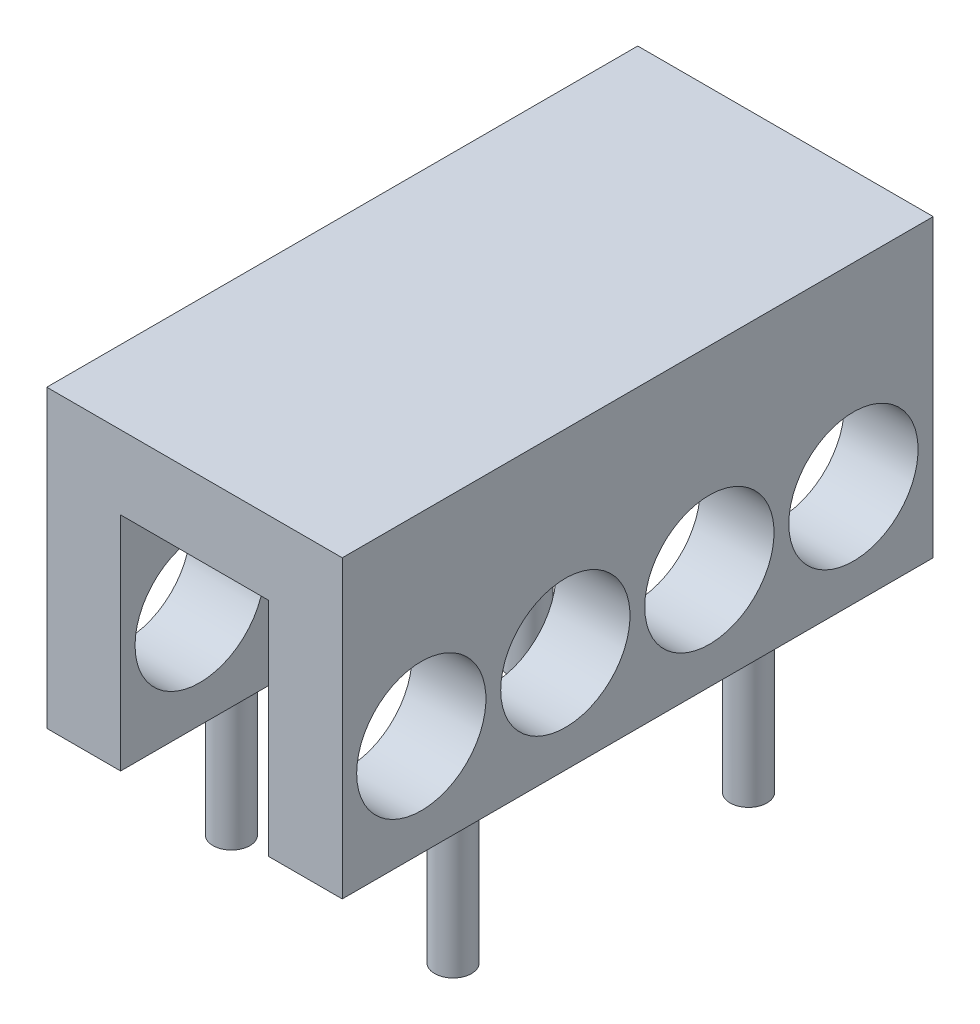
from build123d import *

# Parameters (mm, degrees)
BOSS_EXTRUDE1_DEPTH = 101.6
SKETCH5_R           = 11.1125
CUT_EXTRUDE1_DEPTH  = 125.434078933
SKETCH6_R           = 3.175
BOSS_EXTRUDE3_DEPTH = 25.4


with BuildPart() as part:
    # Sketch4 → Boss-Extrude1 (new body)
    with BuildSketch(Plane.XY):
        Polygon((0, 0), (0, 50.8), (50.8, 50.8), (50.8, 0), (38.1, 0), (38.1, 38.135977337), (12.7, 38.135977337), (12.7, 0), align=None)
    extrude(amount=BOSS_EXTRUDE1_DEPTH)

    # Sketch5 → Cut-Extrude1 (cut, through all)
    with BuildSketch(Plane.ZY):
        with Locations((13.716, 17.4625)):
            Circle(SKETCH5_R)
        with Locations((38.481, 17.4625)):
            Circle(SKETCH5_R)
        with Locations((63.246, 17.4625)):
            Circle(SKETCH5_R)
        with Locations((88.011, 17.4625)):
            Circle(SKETCH5_R)
    extrude(amount=-CUT_EXTRUDE1_DEPTH, mode=Mode.SUBTRACT)

    # Sketch6 → Boss-Extrude3 (add)
    with BuildSketch(Plane.XZ):
        with Locations(Location((6.35, 25.4, 0), (0, 0, 180))):
            Circle(SKETCH6_R)
        with Locations(Location((6.35, 76.2, 0), (0, 0, 180))):
            Circle(SKETCH6_R)
        with Locations(Location((44.45, 76.2, 0), (0, 0, 180))):
            Circle(SKETCH6_R)
        with Locations(Location((44.45, 25.4, 0), (0, 0, 180))):
            Circle(SKETCH6_R)
    extrude(amount=BOSS_EXTRUDE3_DEPTH)


solid = part.part
